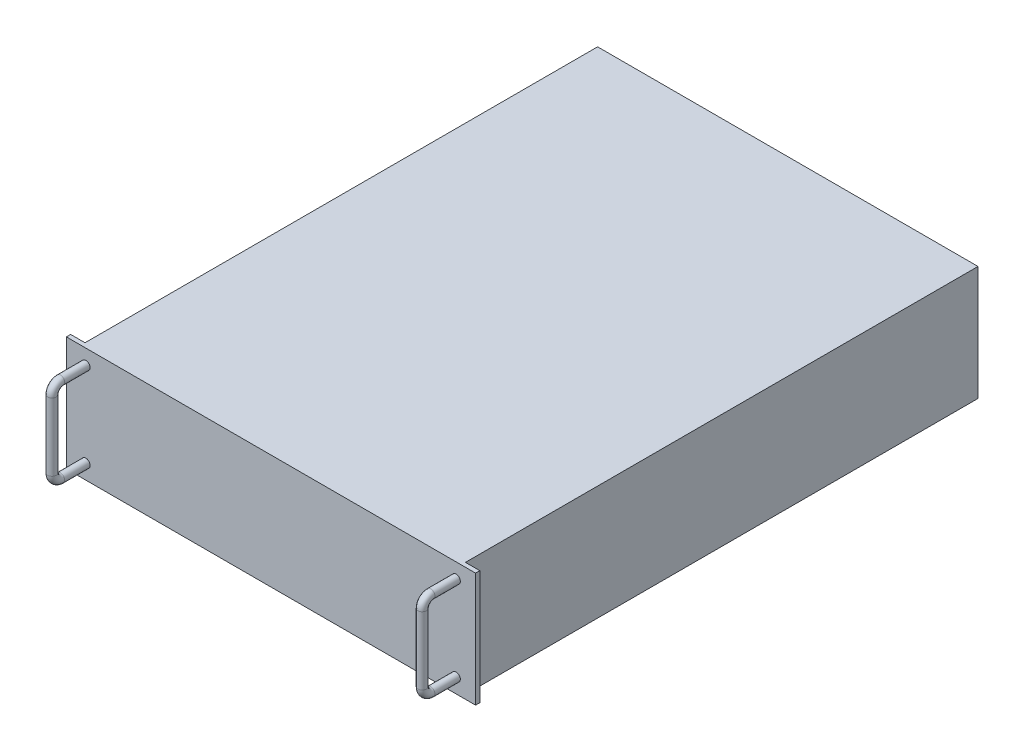
from build123d import *

# Parameters (mm, degrees)
SKETCH1_W           = 483
SKETCH1_H           = 135
BOSS_EXTRUDE1_DEPTH = 610
SKETCH2_W           = 17
SKETCH2_H           = 135
CUT_EXTRUDE1_DEPTH  = 605
SKETCH4_R           = 5


with BuildPart() as part:
    # Sketch1 → Boss-Extrude1 (new body)
    with BuildSketch(Plane.XY):
        with Locations((241.5, 67.5)):
            Rectangle(SKETCH1_W, SKETCH1_H)
    extrude(amount=-BOSS_EXTRUDE1_DEPTH)

    # Sketch2 → Cut-Extrude1 (cut)
    with BuildSketch(Plane(origin=(0, 0, -610), x_dir=(-1, 0, 0), z_dir=(0, 0, -1))):
        with Locations((-474.5, 67.5)):
            Rectangle(SKETCH2_W, SKETCH2_H)
        with Locations((-8.5, 67.5)):
            Rectangle(SKETCH2_W, SKETCH2_H)
    extrude(amount=-CUT_EXTRUDE1_DEPTH, mode=Mode.SUBTRACT)

    # Sweep1: sweep along a path in Sketch3
    with BuildLine(Plane(origin=(460, 0, 0), x_dir=(0, 0, -1), z_dir=(1, 0, 0))) as sweep1_path:
        Line((0, 117.5), (-30, 117.5))
        ThreePointArc((-30, 117.5), (-37.071067812, 114.571067812), (-40, 107.5))
        Line((-40, 107.5), (-40, 27.5))
        ThreePointArc((-40, 27.5), (-37.071067812, 20.428932188), (-30, 17.5))
        Line((-30, 17.5), (0, 17.5))
    # Sketch4 → Sweep1 (sweep)
    with BuildSketch(Plane.XY):
        with Locations((460, 117.5)):
            Circle(SKETCH4_R)
    sweep1 = sweep(path=sweep1_path.line)

    # Mirror1: Sweep1 across plane
    add(sweep1.mirror(Plane(origin=(241.5, 0, 0), x_dir=(0, 0, 1), z_dir=(1, 0, 0))))


solid = part.part
